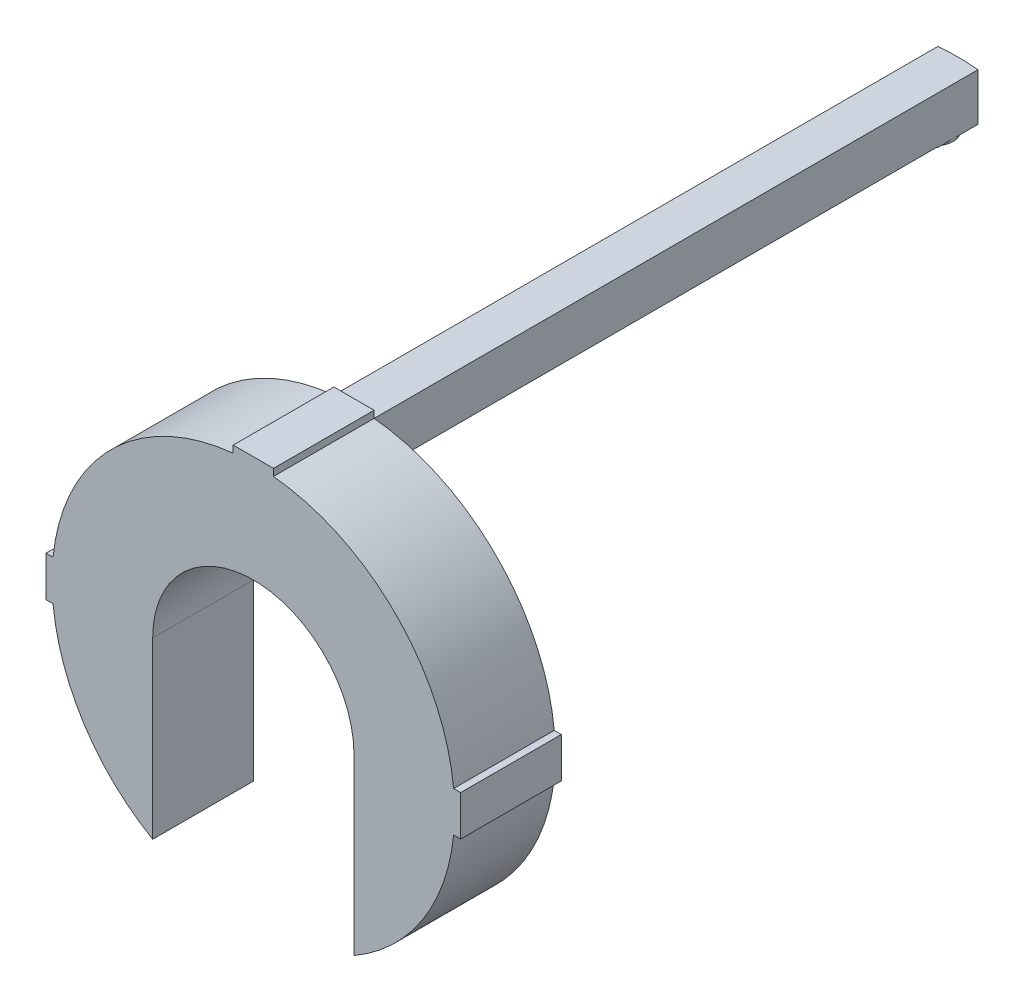
from build123d import *
from build123d.topology import SkipClean

# Parameters (mm, degrees)
SKETCH1_R           = 5
BOSS_EXTRUDE1_DEPTH = 2.5
SKETCH6_W           = 0.25
SKETCH6_H           = 1
BOSS_EXTRUDE4_DEPTH = 2.5
CIRPATTERN1_COUNT   = 4
SKETCH8_R           = 2.5
CUT_EXTRUDE3_DEPTH  = 1.25
SKETCH9_W           = 1
SKETCH9_H           = 1.35
BOSS_EXTRUDE5_DEPTH = 15
SKETCH11_R          = 3.85
CUT_EXTRUDE4_DEPTH  = 14
SKETCH12_R          = 0.48
BOSS_EXTRUDE6_DEPTH = 7
SKETCH13_R          = 3.75
CUT_EXTRUDE5_DEPTH  = 7
CUT_EXTRUDE6_START  = 17
SKETCH14_R          = 6.794989929
SKETCH14_R_2        = 5
CUT_EXTRUDE6_DEPTH  = 17
CUT_EXTRUDE7_DEPTH  = 10


with BuildPart() as part:
    # Sketch1 → Boss-Extrude1 (new body)
    with BuildSketch(Plane.XY):
        Circle(SKETCH1_R)
    extrude(amount=BOSS_EXTRUDE1_DEPTH)

    # Sketch6 → Boss-Extrude4 (add)
    with BuildSketch(Plane.XY.offset(2.5)):
        with Locations((-5.025, 0)):
            Rectangle(SKETCH6_W, SKETCH6_H)
    boss_extrude4 = extrude(amount=-BOSS_EXTRUDE4_DEPTH)

    # CirPattern1: Boss-Extrude4 ×4 about axis
    cirpattern1_axis = Axis((0, 0, 0), (0, 0, 1))
    for i in range(1, CIRPATTERN1_COUNT):
        add(boss_extrude4.rotate(cirpattern1_axis, i * 360 / CIRPATTERN1_COUNT))

    # Sketch8 → Cut-Extrude3 (cut)
    with BuildSketch(Plane.XY.offset(2.5)):
        Circle(SKETCH8_R)
    extrude(amount=-CUT_EXTRUDE3_DEPTH, mode=Mode.SUBTRACT)

    # Sketch9 → Boss-Extrude5 (add)
    with BuildSketch(Plane(origin=(0, 0, 0), x_dir=(-1, 0, 0), z_dir=(0, 0, -1))):
        with Locations((0, 4.475)):
            Rectangle(SKETCH9_W, SKETCH9_H)
    extrude(amount=BOSS_EXTRUDE5_DEPTH)

    # Sketch11 → Cut-Extrude4 (cut)
    with BuildSketch(Plane(origin=(0, 0, 0), x_dir=(-1, 0, 0), z_dir=(0, 0, -1))):
        Circle(SKETCH11_R)
    extrude(amount=CUT_EXTRUDE4_DEPTH, mode=Mode.SUBTRACT)

    # Sketch12 → Boss-Extrude6 (add)
    with BuildSketch(Plane(origin=(0, 5.15, 0), x_dir=(1, 0, 0), z_dir=(0, 1, 0))):
        with Locations(Location((0, 14.4, 0), (0, 0, 180))):
            Circle(SKETCH12_R)
    extrude(amount=-BOSS_EXTRUDE6_DEPTH)

    # Sketch13 → Cut-Extrude5 (cut)
    with BuildSketch(Plane(origin=(0, 0, -15), x_dir=(-1, 0, 0), z_dir=(0, 0, -1))):
        Circle(SKETCH13_R)
    extrude(amount=-CUT_EXTRUDE5_DEPTH, mode=Mode.SUBTRACT)

    # Sketch14 → Cut-Extrude6 (cut)
    with BuildSketch(Plane(origin=(0, 0, 0), x_dir=(-1, 0, 0), z_dir=(0, 0, -1)).offset(CUT_EXTRUDE6_START)):
        Circle(SKETCH14_R)
        Circle(SKETCH14_R_2, mode=Mode.SUBTRACT)
    extrude(amount=-CUT_EXTRUDE6_DEPTH, mode=Mode.SUBTRACT)

    # Sketch15 → Cut-Extrude7 (cut)
    with SkipClean():  # the faces are left unmerged after this step: merging them gives an invalid solid
        with BuildSketch(Plane.XY.offset(2.5)):
            with BuildLine():
                Line((2.5, 0), (2.5, -5))
                ThreePointArc((2.5, -5), (0, -7.5), (-2.5, -5))
                Line((-2.5, -5), (-2.5, 0))
                ThreePointArc((-2.5, 0), (0, 2.5), (2.5, 0))
            make_face()
        extrude(amount=-CUT_EXTRUDE7_DEPTH, mode=Mode.SUBTRACT)


solid = part.part
